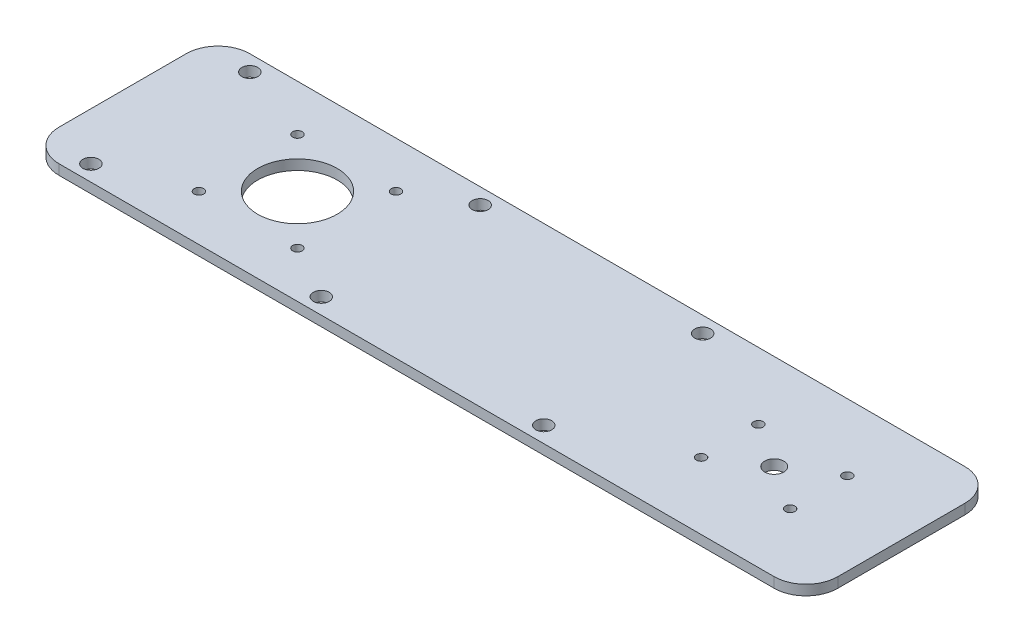
from build123d import *

# Parameters (mm, degrees)
SKETCH1_W             = 245
SKETCH1_H             = 60
BOSS_EXTRUDE1_DEPTH   = 3.175
FILLET1_R             = 10
F_3_0MM_DOWEL_HOLE1_D = 3
SKETCH6_R             = 12.5
CUT_EXTRUDE1_DEPTH    = 193.380042169
F_6_0MM_DOWEL_HOLE1_D = 6
F_3_0MM_DOWEL_HOLE2_D = 3
F_5_0MM_DOWEL_HOLE1_D = 5


with BuildPart() as part:
    # Sketch1 → Boss-Extrude1 (new body)
    with BuildSketch(Plane(origin=(0, 0, 0), x_dir=(1, 0, 0), z_dir=(0, 1, 0))):
        with Locations((67.5, 0)):
            Rectangle(SKETCH1_W, SKETCH1_H)
    extrude(amount=BOSS_EXTRUDE1_DEPTH)

    # Fillet1
    fillet1_edges = [part.edges().sort_by_distance(p)[0] for p in [
        (-55, 1.5875, -30),
        (190, 1.5875, -30),
        (190, 1.5875, 30),
        (-55, 1.5875, 30),
    ]]
    fillet(fillet1_edges, radius=FILLET1_R)

    # Ø3.0mm Dowel Hole1 (through all)
    with Locations(Plane(origin=(0, 3.175, 0), x_dir=(1, 0, 0), z_dir=(0, 1, 0))):
        with Locations((-15.5, 15.5), (15.5, 15.5), (15.5, -15.5), (-15.5, -15.5)):
            Hole(F_3_0MM_DOWEL_HOLE1_D / 2)

    # Sketch6 → Cut-Extrude1 (cut, through all)
    with BuildSketch(Plane(origin=(0, 3.175, 0), x_dir=(1, 0, 0), z_dir=(0, 1, 0))):
        with Locations(Location((0, 0, 0), (0, 0, 270))):
            Circle(SKETCH6_R)
    extrude(amount=-CUT_EXTRUDE1_DEPTH, mode=Mode.SUBTRACT)

    # Ø6.0mm Dowel Hole1 (through all)
    with Locations(Plane(origin=(0, 3.175, 0), x_dir=(1, 0, 0), z_dir=(0, 1, 0))):
        with Locations((150, 0)):
            Hole(F_6_0MM_DOWEL_HOLE1_D / 2)

    # Ø3.0mm Dowel Hole2 (through all)
    with Locations(Plane(origin=(0, 0, 0), x_dir=(-1, 0, 0), z_dir=(0, -1, 0))):
        with Locations((-164, 9), (-136, 9), (-136, -9), (-164, -9)):
            Hole(F_3_0MM_DOWEL_HOLE2_D / 2)

    # Ø5.0mm Dowel Hole1 (through all)
    with Locations(Plane(origin=(0, 3.175, 0), x_dir=(1, 0, 0), z_dir=(0, 1, 0))):
        with Locations((32.5, -25), (102.5, -25), (102.5, 25), (32.5, 25), (-40, -25), (-40, 25)):
            Hole(F_5_0MM_DOWEL_HOLE1_D / 2)


solid = part.part
